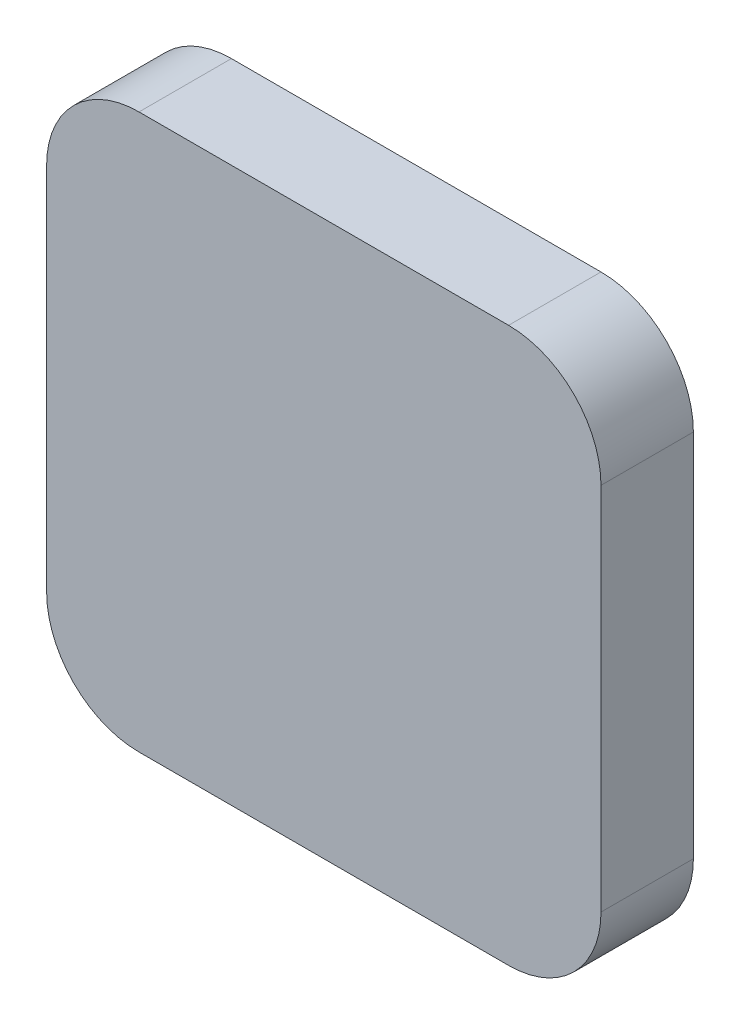
from build123d import *

# Parameters (mm, degrees)
ESBO_O1_W                = 12
ESBO_O1_H                = 12
RESSALTO_EXTRUS_O1_DEPTH = 2
FILETE1_R                = 2


with BuildPart() as part:
    # Esboço1 → Ressalto-extrusão1 (new body)
    with BuildSketch(Plane.XY):
        Rectangle(ESBO_O1_W, ESBO_O1_H)
    extrude(amount=RESSALTO_EXTRUS_O1_DEPTH)

    # Filete1
    filete1_edges = [part.edges().sort_by_distance(p)[0] for p in [
        (-6, 6, 1),
        (6, 6, 1),
        (6, -6, 1),
        (-6, -6, 1),
    ]]
    fillet(filete1_edges, radius=FILETE1_R)


solid = part.part
